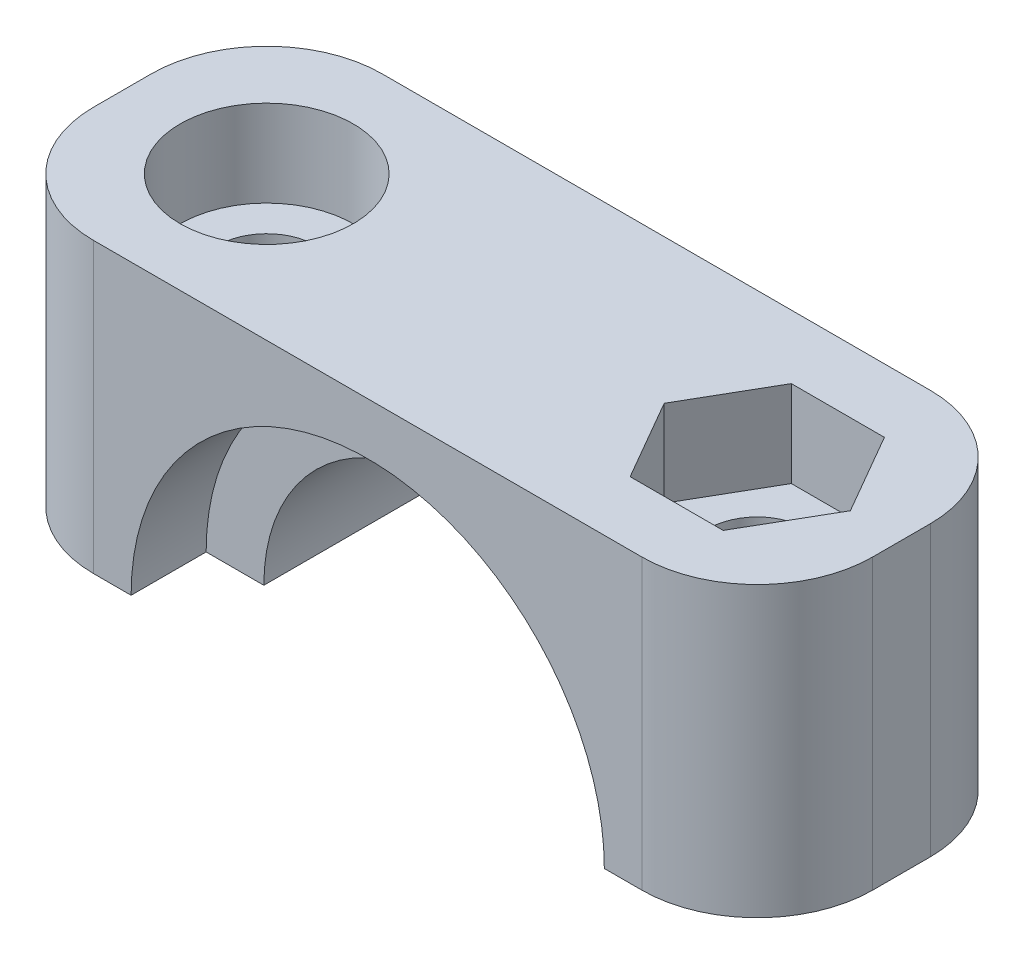
from build123d import *

# Parameters (mm, degrees)
SKETCH1_W           = 27
SKETCH1_H           = 10
BOSS_EXTRUDE1_DEPTH = 10
FILLET1_R           = 4
SKETCH4_R           = 8.2
CUT_EXTRUDE3_DEPTH  = 18.528548143
BOSS_EXTRUDE2_START = 2
BOSS_EXTRUDE2_DEPTH = 5.4
SKETCH2_R           = 1.7
CUT_EXTRUDE1_DEPTH  = 20.551214796
SKETCH3_R           = 3
CUT_EXTRUDE2_DEPTH  = 3


with BuildPart() as part:
    # Sketch1 → Boss-Extrude1 (new body)
    with BuildSketch(Plane.XY):
        Rectangle(SKETCH1_W, SKETCH1_H)
    extrude(amount=BOSS_EXTRUDE1_DEPTH)

    # Fillet1
    fillet1_edges = [part.edges().sort_by_distance(p)[0] for p in [
        (-13.5, 0, 10),
        (13.5, 0, 10),
        (-13.5, 0, 0),
        (13.5, 0, 0),
    ]]
    fillet(fillet1_edges, radius=FILLET1_R)

    # Sketch4 → Cut-Extrude3 (cut, through all)
    with BuildSketch(Plane(origin=(0, 0, 0), x_dir=(-1, 0, 0), z_dir=(0, 0, -1))):
        with Locations((0, -5)):
            Circle(SKETCH4_R)
    extrude(amount=-CUT_EXTRUDE3_DEPTH, mode=Mode.SUBTRACT)

    # Sketch5 → Boss-Extrude2 (add)
    with BuildSketch(Plane.XY.offset(BOSS_EXTRUDE2_START)):
        with BuildLine():
            Line((8.2, -5), (6.2, -5))
            ThreePointArc((6.2, -5), (0, 1.2), (-6.2, -5))
            Line((-6.2, -5), (-8.2, -5))
            ThreePointArc((-8.2, -5), (0, 3.2), (8.2, -5))
        make_face()
    extrude(amount=BOSS_EXTRUDE2_DEPTH)

    # Sketch2 → Cut-Extrude1 (cut, through all)
    with BuildSketch(Plane(origin=(0, 5, 0), x_dir=(1, 0, 0), z_dir=(0, 1, 0))):
        with Locations(Location((-8.5, -5, 0), (0, 0, 270))):
            Circle(SKETCH2_R)
        with Locations(Location((8.5, -5, 0), (0, 0, 270))):
            Circle(SKETCH2_R)
    extrude(amount=-CUT_EXTRUDE1_DEPTH, mode=Mode.SUBTRACT)

    # Sketch3 → Cut-Extrude2 (cut)
    with BuildSketch(Plane(origin=(0, 5, 0), x_dir=(1, 0, 0), z_dir=(0, 1, 0))):
        with Locations(Location((-8.5, -5, 0), (0, 0, 270))):
            Circle(SKETCH3_R)
        Polygon((6.887284606, -7.793305), (10.112715394, -7.793305), (11.725430787, -5), (10.112715394, -2.206695), (6.887284606, -2.206695), (5.274569213, -5), align=None)
    extrude(amount=-CUT_EXTRUDE2_DEPTH, mode=Mode.SUBTRACT)


solid = part.part
